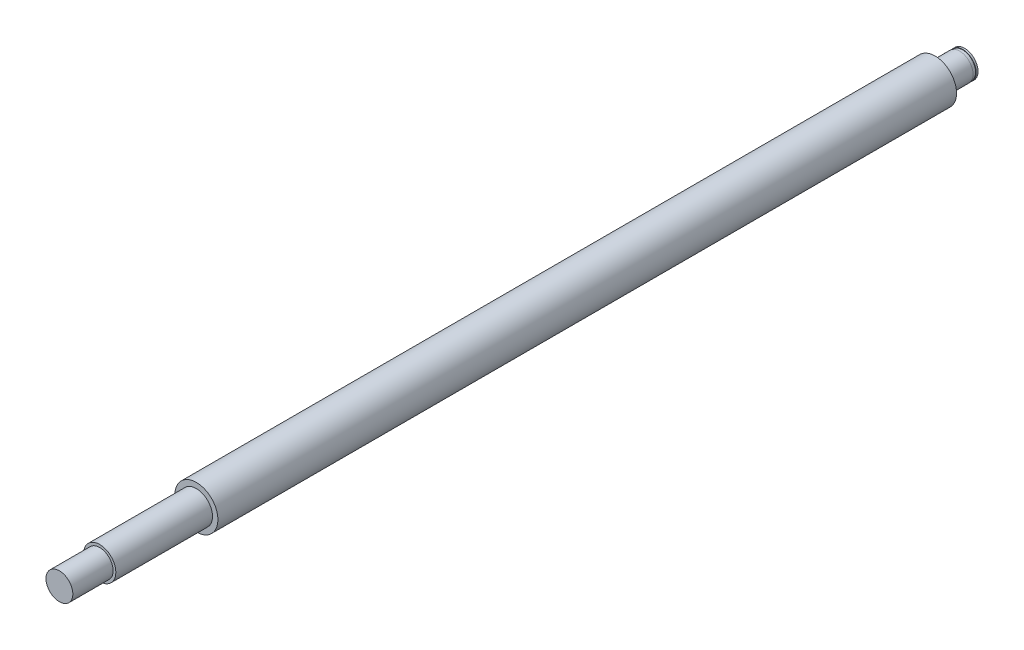
from build123d import *

# Parameters (mm, degrees)
SKETCH1_R           = 8
BOSS_EXTRUDE1_DEPTH = 275
SKETCH2_R           = 6
BOSS_EXTRUDE2_DEPTH = 36
SKETCH3_R           = 5
BOSS_EXTRUDE3_DEPTH = 15
BOSS_EXTRUDE4_START = 9.15
SKETCH4_R           = 5
BOSS_EXTRUDE4_DEPTH = 9.15
SKETCH5_R           = 4.8
BOSS_EXTRUDE5_DEPTH = 1.15
BOSS_EXTRUDE6_START = 0.7
SKETCH7_R           = 5
BOSS_EXTRUDE6_DEPTH = 0.7


with BuildPart() as part:
    # Sketch1 → Boss-Extrude1 (new body)
    with BuildSketch(Plane.XY):
        Circle(SKETCH1_R)
    extrude(amount=-BOSS_EXTRUDE1_DEPTH)

    # Sketch2 → Boss-Extrude2 (add)
    with BuildSketch(Plane.XY):
        Circle(SKETCH2_R)
    extrude(amount=BOSS_EXTRUDE2_DEPTH)

    # Sketch3 → Boss-Extrude3 (add)
    with BuildSketch(Plane.XY.offset(36)):
        Circle(SKETCH3_R)
    extrude(amount=BOSS_EXTRUDE3_DEPTH)

    # Sketch4 → Boss-Extrude4 (add)
    with BuildSketch(Plane(origin=(0, 0, -275), x_dir=(-1, 0, 0), z_dir=(0, 0, -1)).offset(BOSS_EXTRUDE4_START)):
        with Locations(Location((0, 0, 0), (0, 0, 180))):
            Circle(SKETCH4_R)
    extrude(amount=-BOSS_EXTRUDE4_DEPTH)

    # Sketch5 → Boss-Extrude5 (add)
    with BuildSketch(Plane(origin=(0, 0, -284.15), x_dir=(-1, 0, 0), z_dir=(0, 0, -1))):
        Circle(SKETCH5_R)
    extrude(amount=BOSS_EXTRUDE5_DEPTH)

    # Sketch7 → Boss-Extrude6 (add)
    with BuildSketch(Plane(origin=(0, 0, -285.3), x_dir=(-1, 0, 0), z_dir=(0, 0, -1)).offset(BOSS_EXTRUDE6_START)):
        with Locations(Location((0, 0, 0), (0, 0, 180))):
            Circle(SKETCH7_R)
    extrude(amount=-BOSS_EXTRUDE6_DEPTH)


solid = part.part
